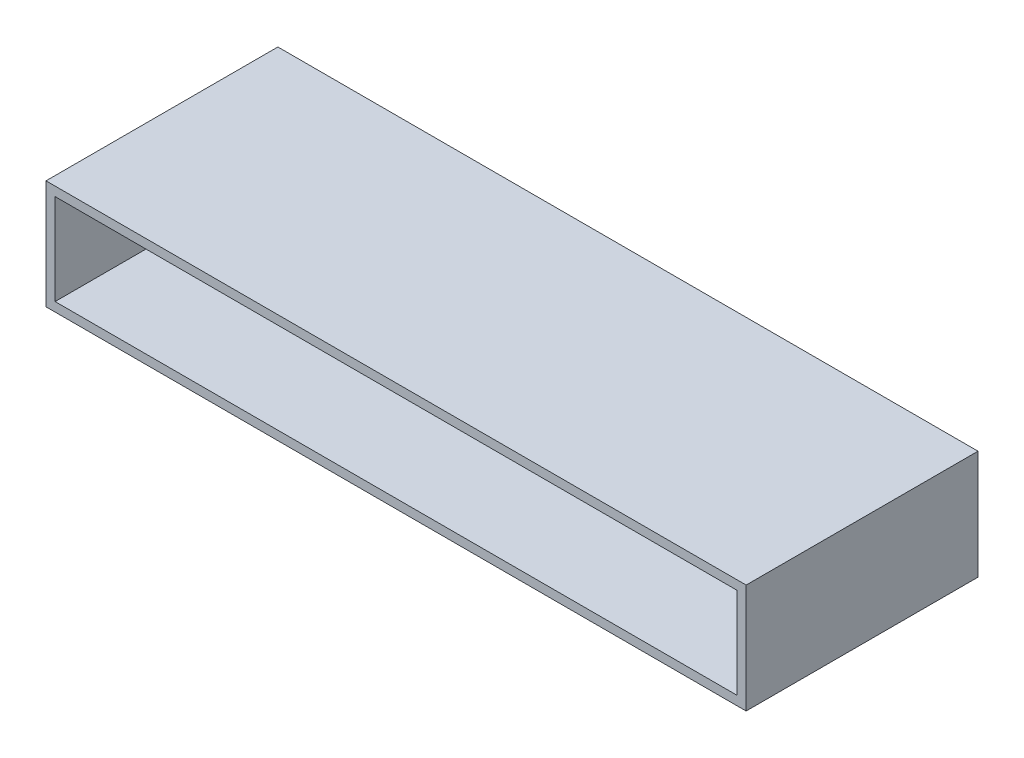
from build123d import *

# Parameters (mm, degrees)
SKETCH1_W     = 154
SKETCH1_H     = 24
SKETCH1_W_2   = 150
SKETCH1_H_2   = 20
PROFILE_DEPTH = 51
SKETCH2_W     = 150
SKETCH2_H     = 20
BACK_DEPTH    = 2


with BuildPart() as part:
    # Sketch1 → Profile (new body)
    with BuildSketch(Plane.XY):
        with Locations((77, 12)):
            Rectangle(SKETCH1_W, SKETCH1_H)
        with Locations((77, 12)):
            Rectangle(SKETCH1_W_2, SKETCH1_H_2, mode=Mode.SUBTRACT)
    extrude(amount=PROFILE_DEPTH)

    # Sketch2 → Back (add)
    with BuildSketch(Plane.XY):
        with Locations((77, 12)):
            Rectangle(SKETCH2_W, SKETCH2_H)
    extrude(amount=BACK_DEPTH)


solid = part.part
